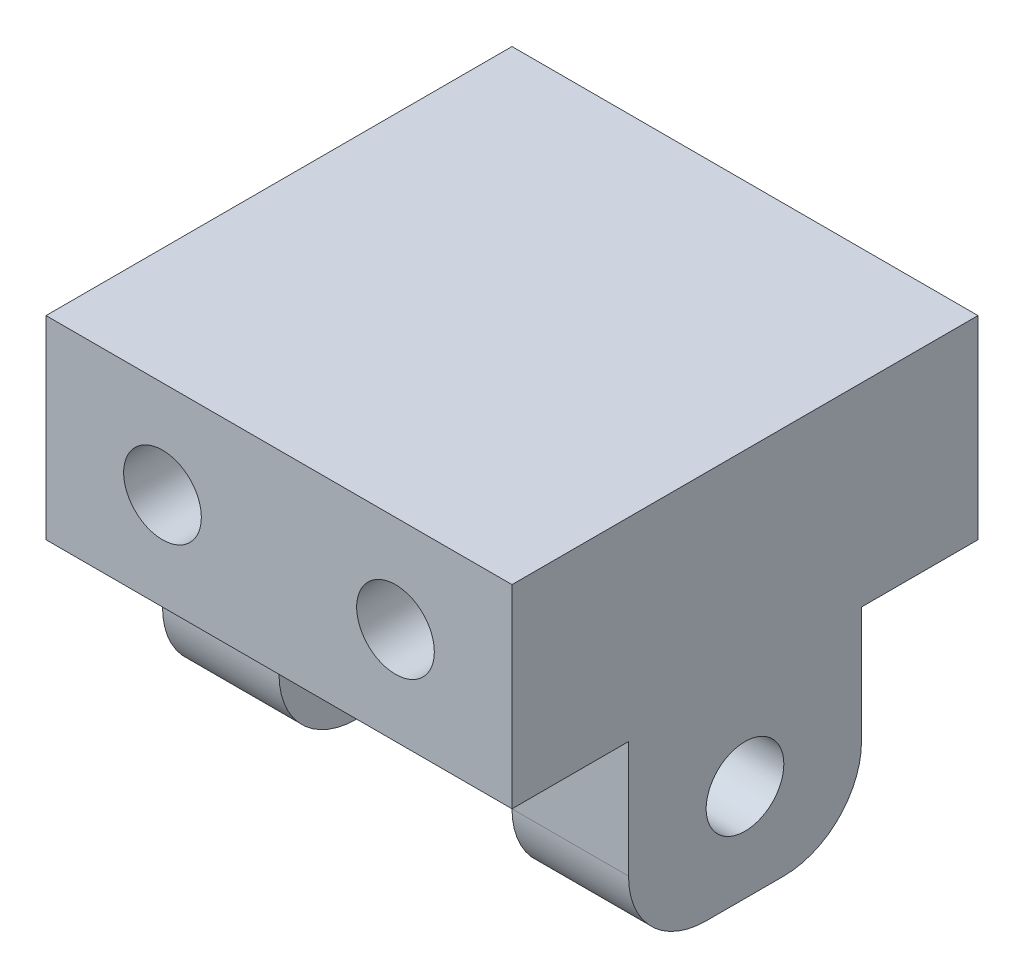
from build123d import *

# Parameters (mm, degrees)
BOSS_EXTRUDE1_DEPTH      = 6
BOSS_EXTRUDE1_DEPTH_BACK = 6
SKETCH1_W                = 12
SKETCH1_H                = 5
SKETCH2_R                = 1
CUT_EXTRUDE1_DEPTH       = 12
SKETCH3_W                = 6
SKETCH3_H                = 5
SKETCH3_R                = 1
BOSS_EXTRUDE2_DEPTH      = 3
FILLET1_R                = 2
FILLET1_OF_MIRROR1_R     = 2


with BuildPart() as part:
    # Sketch1 → Boss-Extrude1 (new, two sides: drawn at the far end of the back side and taken through both)
    with BuildSketch(Plane.XY.offset(-BOSS_EXTRUDE1_DEPTH_BACK)):
        Rectangle(SKETCH1_W, SKETCH1_H)
    extrude(amount=BOSS_EXTRUDE1_DEPTH + BOSS_EXTRUDE1_DEPTH_BACK)

    # Sketch2 → Cut-Extrude1 (cut)
    with BuildSketch(Plane.XY.offset(6)):
        with Locations((-3, 0)):
            Circle(SKETCH2_R)
        with Locations((3, 0)):
            Circle(SKETCH2_R)
    extrude(amount=-CUT_EXTRUDE1_DEPTH, mode=Mode.SUBTRACT)

    # Sketch3 → Boss-Extrude2 (add)
    with BuildSketch(Plane(origin=(6, 0, 0), x_dir=(0, 0, -1), z_dir=(1, 0, 0))):
        with Locations((0, -5)):
            Rectangle(SKETCH3_W, SKETCH3_H)
        with Locations((0, -5)):
            Circle(SKETCH3_R, mode=Mode.SUBTRACT)
    boss_extrude2 = extrude(amount=-BOSS_EXTRUDE2_DEPTH)

    # Fillet1
    fillet1_edges = [part.edges().sort_by_distance(p)[0] for p in [
        (4.5, -7.5, 3),
        (4.5, -7.5, -3),
    ]]
    fillet(fillet1_edges, radius=FILLET1_R)

    # Mirror1: Boss-Extrude2 across plane
    add(boss_extrude2.mirror(Plane(origin=(0, 0, 0), x_dir=(0, 0, 1), z_dir=(1, 0, 0))))

    # Fillet1 of Mirror1
    fillet1_of_mirror1_edges = [part.edges().sort_by_distance(p)[0] for p in [
        (-4.5, -7.5, 3),
        (-4.5, -7.5, -3),
    ]]
    fillet(fillet1_of_mirror1_edges, radius=FILLET1_OF_MIRROR1_R)


solid = part.part
